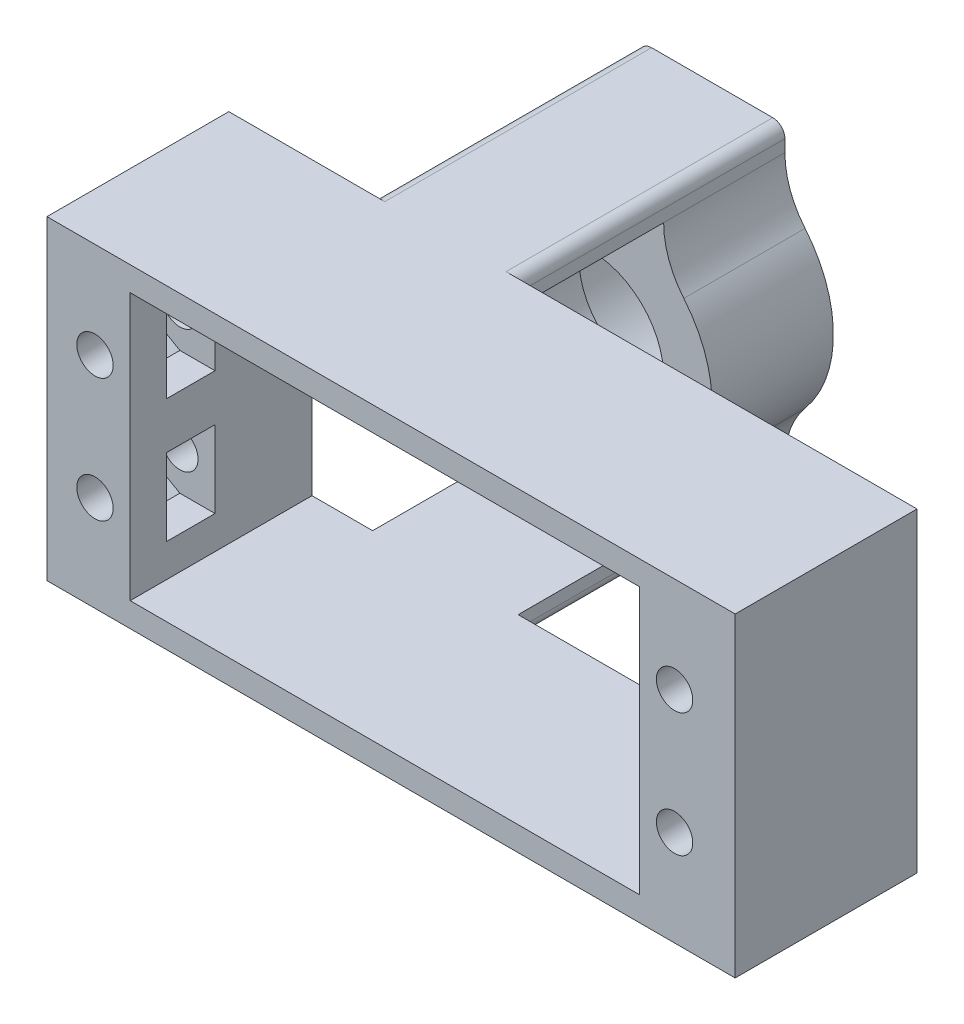
from build123d import *

# Parameters (mm, degrees)
ESQUISSE1_W                   = 80
ESQUISSE1_H                   = 26
BOSS_EXTRU_1_DEPTH            = 5
ESQUISSE4_W                   = 15
ESQUISSE4_H                   = 21
BOSS_EXTRU_2_DEPTH            = 23
ESQUISSE6_R                   = 1.9
ENL_V_MAT_EXTRU_1_DEPTH       = 23
ESQUISSE7_R                   = 2.5
ENL_V_MAT_EXTRU_2_DEPTH       = 33
ESQUISSE8_W                   = 23.844388633
ESQUISSE8_H                   = 15
ENL_V_MAT_EXTRU_3_DEPTH       = 20
ENL_V_MAT_EXTRU_4_DEPTH       = 20
ENL_V_MAT_EXTRU_5_DEPTH       = 25
ENL_V_MAT_EXTRU_7_DEPTH       = 25
ENL_V_MAT_EXTRU_8_DEPTH       = 1
BOSS_EXTRU_3_DEPTH            = 2
ESQUISSE15_R                  = 1.5
ENL_V_MAT_EXTRU_9_DEPTH       = 19
ESQUISSE17_W                  = 42
ESQUISSE17_H                  = 22
ENL_V_MAT_EXTRU_11_DEPTH      = 19
ENL_V_MAT_EXTRU_12_DEPTH      = 2
BOSS_EXTRU_4_DEPTH            = 22
BOSS_EXTRU_5_DEPTH            = 10
ESQUISSE25_R                  = 8
ENL_V_MAT_EXTRU_13_DEPTH      = 5
ESQUISSE26_R                  = 6
ENL_V_MAT_EXTRU_14_DEPTH      = 5
BOSS_EXTRU_7_DEPTH            = 10
ESQUISSE35_W                  = 3.859922035
ESQUISSE35_H                  = 6.350852961
ESQUISSE35_W_2                = 3.756368621
ESQUISSE35_W_3                = 10.8376001
ESQUISSE35_W_4                = 8.369035633
ENL_V_MAT_EXTRU_17_DEPTH      = 12
ESQUISSE37_W                  = 8.298839711
ESQUISSE37_H                  = 26
BOSS_EXTRU_8_DEPTH            = 8
BOSS_EXTRU_9_DEPTH            = 21
ENL_V_START                   = -10
ESQUISSE42_R                  = 1.5
ENL_V_MAT_EXTRU_18_DEPTH      = 10
ENL_V_MAT_EXTRU_19_DEPTH      = 70.721697714
ENL_V_MAT_EXTRU_19_DEPTH_BACK = 70.721697714
ESQUISSE43_W                  = 41.770498162
ESQUISSE43_H                  = 26


with BuildPart() as part:
    # Esquisse1 → Boss.-Extru.1 (new body)
    with BuildSketch(Plane.XY):
        with Locations((16.761307699, -3.439862543)):
            Rectangle(ESQUISSE1_W, ESQUISSE1_H)
    extrude(amount=BOSS_EXTRU_1_DEPTH)

    # Esquisse4 → Boss.-Extru.2 (add)
    with BuildSketch(Plane(origin=(0, 0, 0), x_dir=(-1, 0, 0), z_dir=(0, 0, -1))):
        with Locations((30.738692301, -3.439862543)):
            Rectangle(ESQUISSE4_W, ESQUISSE4_H)
    extrude(amount=-BOSS_EXTRU_2_DEPTH)

    # Esquisse6 → Enlèv. mat.-Extru.1 (cut)
    with BuildSketch(Plane.XZ.offset(13.939862543)):
        with Locations((-28.738692301, 5)):
            Circle(ESQUISSE6_R)
    extrude(amount=-ENL_V_MAT_EXTRU_1_DEPTH, mode=Mode.SUBTRACT)

    # Esquisse7 → Enlèv. mat.-Extru.2 (cut)
    with BuildSketch(Plane.XY.offset(23)):
        with Locations((-33.238692301, -3.439862543)):
            Circle(ESQUISSE7_R)
    extrude(amount=-ENL_V_MAT_EXTRU_2_DEPTH, mode=Mode.SUBTRACT)

    # Esquisse8 → Enlèv. mat.-Extru.3 (cut)
    with BuildSketch(Plane(origin=(0, 0, 0), x_dir=(-1, 0, 0), z_dir=(0, 0, -1))):
        with Locations((38.160886617, -3.439862543)):
            Rectangle(ESQUISSE8_W, ESQUISSE8_H)
    extrude(amount=-ENL_V_MAT_EXTRU_3_DEPTH, mode=Mode.SUBTRACT)

    # Esquisse9 → Enlèv. mat.-Extru.4 (cut)
    with BuildSketch(Plane(origin=(0, 0, 0), x_dir=(-1, 0, 0), z_dir=(0, 0, -1))):
        with BuildLine():
            Line((23.238692301, 7.060137457), (23.238692301, 9.560137457))
            Line((23.238692301, 9.560137457), (17.813492819, 9.560137457))
            ThreePointArc((17.813492819, 9.560137457), (20.800246467, 8.905073311), (23.238692301, 7.060137457))
        make_face()
        with BuildLine():
            Line((17.813492819, -16.439862543), (23.238692301, -16.439862543))
            Line((23.238692301, -16.439862543), (23.238692301, -13.939862543))
            ThreePointArc((23.238692301, -13.939862543), (20.800246467, -15.784798397), (17.813492819, -16.439862543))
        make_face()
    extrude(amount=-ENL_V_MAT_EXTRU_4_DEPTH, mode=Mode.SUBTRACT)

    # Esquisse10 → Enlèv. mat.-Extru.5 (cut)
    with BuildSketch(Plane.XZ.offset(13.939862543)):
        with BuildLine():
            Line((-23.238692301, 21.5), (-23.238692301, 23))
            Line((-23.238692301, 23), (-24.738692301, 23))
            ThreePointArc((-24.738692301, 23), (-23.678032129, 22.560660172), (-23.238692301, 21.5))
        make_face()
    extrude(amount=-ENL_V_MAT_EXTRU_5_DEPTH, mode=Mode.SUBTRACT)

    # Esquisse12 → Enlèv. mat.-Extru.7 (cut)
    with BuildSketch(Plane.XZ.offset(13.939862543)):
        with BuildLine():
            Line((-38.238692301, 23), (-36.738692301, 23))
            ThreePointArc((-36.738692301, 23), (-37.799352472, 22.560660172), (-38.238692301, 21.5))
            Line((-38.238692301, 21.5), (-38.238692301, 23))
        make_face()
    extrude(amount=-ENL_V_MAT_EXTRU_7_DEPTH, mode=Mode.SUBTRACT)

    # Esquisse13 → Enlèv. mat.-Extru.8 (cut)
    with BuildSketch(Plane(origin=(0, 7.060137457, 0), x_dir=(1, 0, 0), z_dir=(0, 1, 0))):
        Polygon((-30.759418243, -1.5), (-32.780144185, -5), (-30.759418243, -8.5), (-26.717966358, -8.5), (-24.697240416, -5), (-26.717966358, -1.5), align=None)
    extrude(amount=-ENL_V_MAT_EXTRU_8_DEPTH, mode=Mode.SUBTRACT)

    # Esquisse14 → Boss.-Extru.3 (add)
    with BuildSketch(Plane(origin=(0, 7.060137457, 0), x_dir=(1, 0, 0), z_dir=(0, 1, 0))):
        Polygon((-25.851940955, 0), (-31.625443646, 0), (-34.512194992, -5), (-31.625443646, -10), (-25.851940955, -10), (-23.238692301, -5.473720558), (-23.238692301, -4.526279442), align=None)
        Polygon((-30.759418243, -1.5), (-32.780144185, -5), (-30.759418243, -8.5), (-26.717966358, -8.5), (-24.697240416, -5), (-26.717966358, -1.5), align=None, mode=Mode.SUBTRACT)
    extrude(amount=BOSS_EXTRU_3_DEPTH)

    # Esquisse15 → Enlèv. mat.-Extru.9 (cut)
    with BuildSketch(Plane(origin=(0, 0, 0), x_dir=(-1, 0, 0), z_dir=(0, 0, -1))):
        with Locations((-51.761307699, -8.539862543)):
            Circle(ESQUISSE15_R)
        with Locations((-51.761307699, 1.660137457)):
            Circle(ESQUISSE15_R)
        with Locations((-3.961307699, -8.539862543)):
            Circle(ESQUISSE15_R)
        with Locations((-3.961307699, 1.660137457)):
            Circle(ESQUISSE15_R)
    extrude(amount=-ENL_V_MAT_EXTRU_9_DEPTH, mode=Mode.SUBTRACT)

    # Esquisse17 → Enlèv. mat.-Extru.11 (cut)
    with BuildSketch(Plane.XY.offset(5)):
        with Locations((27.861307699, -3.439862543)):
            Rectangle(ESQUISSE17_W, ESQUISSE17_H)
    extrude(amount=-ENL_V_MAT_EXTRU_11_DEPTH, mode=Mode.SUBTRACT)

    # Esquisse18 → Enlèv. mat.-Extru.12 (cut)
    with BuildSketch(Plane(origin=(0, 0, 0), x_dir=(-1, 0, 0), z_dir=(0, 0, -1))):
        Polygon((-49.011307699, 3.247850697), (-51.761307699, 4.835563938), (-54.511307699, 3.247850697), (-54.511307699, 0.072424217), (-51.761307699, -1.515289023), (-49.011307699, 0.072424217), (-46.261307699, 1.660137457), align=None)
        Polygon((-49.011307699, -6.952149303), (-51.761307699, -5.364436062), (-54.511307699, -6.952149303), (-54.511307699, -10.127575783), (-51.761307699, -11.715289023), (-49.011307699, -10.127575783), (-46.261307699, -8.539862543), align=None)
        Polygon((-6.711307699, 0.072424217), (-9.461307699, 1.660137457), (-6.711307699, 3.247850697), (-3.961307699, 4.835563938), (-1.211307699, 3.247850697), (-1.211307699, 0.072424217), (-3.961307699, -1.515289023), align=None)
        Polygon((-9.461307699, -8.539862543), (-6.711307699, -6.952149303), (-3.961307699, -5.364436062), (-1.211307699, -6.952149303), (-1.211307699, -10.127575783), (-3.961307699, -11.715289023), (-6.711307699, -10.127575783), align=None)
    extrude(amount=-ENL_V_MAT_EXTRU_12_DEPTH, mode=Mode.SUBTRACT)

    # Esquisse19 → Boss.-Extru.4 (add)
    with BuildSketch(Plane(origin=(0, 0, 0), x_dir=(-1, 0, 0), z_dir=(0, 0, -1))):
        with BuildLine():
            Line((-12.861307699, -16.439862543), (-22.861307699, -16.439862543))
            ThreePointArc((-22.861307699, -16.439862543), (-23.568414481, -16.146969324), (-23.861307699, -15.439862543))
            Line((-23.861307699, -15.439862543), (-23.861307699, -14.439862543))
            Line((-23.861307699, -14.439862543), (-11.861307699, -14.439862543))
            Line((-11.861307699, -14.439862543), (-11.861307699, -15.439862543))
            ThreePointArc((-11.861307699, -15.439862543), (-12.154200918, -16.146969324), (-12.861307699, -16.439862543))
        make_face()
        with BuildLine():
            Line((-23.861307699, 8.560137457), (-23.861307699, 7.560137457))
            Line((-23.861307699, 7.560137457), (-11.861307699, 7.560137457))
            Line((-11.861307699, 7.560137457), (-11.861307699, 8.560137457))
            ThreePointArc((-11.861307699, 8.560137457), (-12.154200918, 9.267244238), (-12.861307699, 9.560137457))
            Line((-12.861307699, 9.560137457), (-22.861307699, 9.560137457))
            ThreePointArc((-22.861307699, 9.560137457), (-23.568414481, 9.267244238), (-23.861307699, 8.560137457))
        make_face()
    extrude(amount=BOSS_EXTRU_4_DEPTH)

    # Esquisse23 → Boss.-Extru.5 (add)
    with BuildSketch(Plane(origin=(0, 0, -22), x_dir=(-1, 0, 0), z_dir=(0, 0, -1))):
        with BuildLine():
            Line((-23.861307699, 8.560137457), (-23.861307699, 7.560137457))
            ThreePointArc((-23.861307699, 7.560137457), (-24.290279557, 5.125218133), (-25.525541276, 2.983495121))
            ThreePointArc((-25.525541276, 2.983495121), (-27.861307699, -3.439862543), (-25.525541276, -9.863220207))
            ThreePointArc((-25.525541276, -9.863220207), (-24.290279557, -12.004943218), (-23.861307699, -14.439862543))
            Line((-23.861307699, -14.439862543), (-23.861307699, -15.439862543))
            ThreePointArc((-23.861307699, -15.439862543), (-23.568414481, -16.146969324), (-22.861307699, -16.439862543))
            Line((-22.861307699, -16.439862543), (-12.861307699, -16.439862543))
            ThreePointArc((-12.861307699, -16.439862543), (-12.154200918, -16.146969324), (-11.861307699, -15.439862543))
            Line((-11.861307699, -15.439862543), (-11.861307699, -14.439862543))
            ThreePointArc((-11.861307699, -14.439862543), (-11.432335842, -12.004943218), (-10.197074123, -9.863220207))
            ThreePointArc((-10.197074123, -9.863220207), (-7.861307699, -3.439862543), (-10.197074123, 2.983495121))
            ThreePointArc((-10.197074123, 2.983495121), (-11.432335842, 5.125218133), (-11.861307699, 7.560137457))
            Line((-11.861307699, 7.560137457), (-11.861307699, 8.560137457))
            ThreePointArc((-11.861307699, 8.560137457), (-12.154200918, 9.267244238), (-12.861307699, 9.560137457))
            Line((-12.861307699, 9.560137457), (-22.861307699, 9.560137457))
            ThreePointArc((-22.861307699, 9.560137457), (-23.568414481, 9.267244238), (-23.861307699, 8.560137457))
        make_face()
    extrude(amount=BOSS_EXTRU_5_DEPTH)

    # Esquisse25 → Enlèv. mat.-Extru.13 (cut)
    with BuildSketch(Plane(origin=(0, 0, -32), x_dir=(-1, 0, 0), z_dir=(0, 0, -1))):
        with Locations((-17.861307699, -3.439862543)):
            Circle(ESQUISSE25_R)
    extrude(amount=-ENL_V_MAT_EXTRU_13_DEPTH, mode=Mode.SUBTRACT)

    # Esquisse26 → Enlèv. mat.-Extru.14 (cut)
    with BuildSketch(Plane(origin=(0, 0, -27), x_dir=(-1, 0, 0), z_dir=(0, 0, -1))):
        with Locations((-17.861307699, -3.439862543)):
            Circle(ESQUISSE26_R)
    extrude(amount=-ENL_V_MAT_EXTRU_14_DEPTH, mode=Mode.SUBTRACT)

    # Esquisse33 → Boss.-Extru.7 (add)
    with BuildSketch(Plane(origin=(0, 0, 0), x_dir=(-1, 0, 0), z_dir=(0, 0, -1))):
        with BuildLine():
            Line((23.238692301, -13.939862543), (23.238692301, 7.060137457))
            ThreePointArc((23.238692301, 7.060137457), (20.800246467, 8.905073311), (17.813492819, 9.560137457))
            Line((17.813492819, 9.560137457), (-12.861307699, 9.560137457))
            ThreePointArc((-12.861307699, 9.560137457), (-12.154200918, 9.267244238), (-11.861307699, 8.560137457))
            Line((-11.861307699, 8.560137457), (-11.861307699, 7.560137457))
            Line((-11.861307699, 7.560137457), (-6.861307699, 7.560137457))
            Line((-6.861307699, 7.560137457), (-6.861307699, 3.161248157))
            Line((-6.861307699, 3.161248157), (-3.961307699, 4.835563938))
            Line((-3.961307699, 4.835563938), (-1.211307699, 3.247850697))
            Line((-1.211307699, 3.247850697), (-1.211307699, 0.072424217))
            Line((-1.211307699, 0.072424217), (-3.961307699, -1.515289023))
            Line((-3.961307699, -1.515289023), (-6.861307699, 0.159026757))
            Line((-6.861307699, 0.159026757), (-6.861307699, -7.038751843))
            Line((-6.861307699, -7.038751843), (-3.961307699, -5.364436062))
            Line((-3.961307699, -5.364436062), (-1.211307699, -6.952149303))
            Line((-1.211307699, -6.952149303), (-1.211307699, -10.127575783))
            Line((-1.211307699, -10.127575783), (-3.961307699, -11.715289023))
            Line((-3.961307699, -11.715289023), (-6.861307699, -10.040973243))
            Line((-6.861307699, -10.040973243), (-6.861307699, -14.439862543))
            Line((-6.861307699, -14.439862543), (-11.861307699, -14.439862543))
            Line((-11.861307699, -14.439862543), (-11.861307699, -15.439862543))
            ThreePointArc((-11.861307699, -15.439862543), (-12.154200918, -16.146969324), (-12.861307699, -16.439862543))
            Line((-12.861307699, -16.439862543), (17.813492819, -16.439862543))
            ThreePointArc((17.813492819, -16.439862543), (20.800246467, -15.784798397), (23.238692301, -13.939862543))
        make_face()
        with BuildLine():
            Line((-56.761307699, -16.439862543), (-22.861307699, -16.439862543))
            ThreePointArc((-22.861307699, -16.439862543), (-23.568414481, -16.146969324), (-23.861307699, -15.439862543))
            Line((-23.861307699, -15.439862543), (-23.861307699, -14.439862543))
            Line((-23.861307699, -14.439862543), (-48.861307699, -14.439862543))
            Line((-48.861307699, -14.439862543), (-48.861307699, -10.040973243))
            Line((-48.861307699, -10.040973243), (-51.761307699, -11.715289023))
            Line((-51.761307699, -11.715289023), (-54.511307699, -10.127575783))
            Line((-54.511307699, -10.127575783), (-54.511307699, -6.952149303))
            Line((-54.511307699, -6.952149303), (-51.761307699, -5.364436062))
            Line((-51.761307699, -5.364436062), (-48.861307699, -7.038751843))
            Line((-48.861307699, -7.038751843), (-48.861307699, 0.159026757))
            Line((-48.861307699, 0.159026757), (-51.761307699, -1.515289023))
            Line((-51.761307699, -1.515289023), (-54.511307699, 0.072424217))
            Line((-54.511307699, 0.072424217), (-54.511307699, 3.247850697))
            Line((-54.511307699, 3.247850697), (-51.761307699, 4.835563938))
            Line((-51.761307699, 4.835563938), (-48.861307699, 3.161248157))
            Line((-48.861307699, 3.161248157), (-48.861307699, 7.560137457))
            Line((-48.861307699, 7.560137457), (-23.861307699, 7.560137457))
            Line((-23.861307699, 7.560137457), (-23.861307699, 8.560137457))
            ThreePointArc((-23.861307699, 8.560137457), (-23.568414481, 9.267244238), (-22.861307699, 9.560137457))
            Line((-22.861307699, 9.560137457), (-56.761307699, 9.560137457))
            Line((-56.761307699, 9.560137457), (-56.761307699, -16.439862543))
        make_face()
    extrude(amount=BOSS_EXTRU_7_DEPTH)

    # Esquisse35 → Enlèv. mat.-Extru.17 (cut)
    with BuildSketch(Plane(origin=(0, 0, -10), x_dir=(-1, 0, 0), z_dir=(0, 0, -1))):
        with Locations((-5.891268716, 1.660137457)):
            Rectangle(ESQUISSE35_W, ESQUISSE35_H)
        with Locations((-5.83949201, -8.539862542)):
            Rectangle(ESQUISSE35_W_2, ESQUISSE35_H)
        with Locations((-46.342507649, 1.660137457)):
            Rectangle(ESQUISSE35_W_3, ESQUISSE35_H)
        with Locations((-47.576789883, -8.539862542)):
            Rectangle(ESQUISSE35_W_4, ESQUISSE35_H)
    extrude(amount=-ENL_V_MAT_EXTRU_17_DEPTH, mode=Mode.SUBTRACT)

    # Esquisse37 → Boss.-Extru.8 (add)
    with BuildSketch(Plane(origin=(0, 0, -10), x_dir=(-1, 0, 0), z_dir=(0, 0, -1))):
        Polygon((-55.51948102, 1.423088184), (-55.51948102, -7.920901253), (-55.066451899, -9.932075987), (-53.340761864, -11.715289023), (-48.861307699, -11.715289023), (-48.861307699, 4.835563938), (-52.662543063, 4.835563938), (-54.892065561, 3.297290773), align=None)
        with Locations((-2.711887844, -3.439862543)):
            Rectangle(ESQUISSE37_W, ESQUISSE37_H)
    extrude(amount=-BOSS_EXTRU_8_DEPTH)

    # Esquisse38 → Boss.-Extru.9 (add)
    with BuildSketch(Plane.XZ.offset(13.939862543)):
        with BuildLine():
            Line((-23.238692301, 21.5), (-23.238692301, 5))
            Line((-23.238692301, 5), (-6.738692301, 5))
            ThreePointArc((-6.738692301, 5), (-18.40595419, 9.83273811), (-23.238692301, 21.5))
        make_face()
    extrude(amount=-BOSS_EXTRU_9_DEPTH)

    # Esquisse42 → Enlèv. mat.-Extru.18 (cut)
    with BuildSketch(Plane.XY.offset(5).offset(ENL_V_START)):
        with Locations(Location((3.961307699, 1.660137457, 0), (0, 0, 180))):
            Circle(ESQUISSE42_R)
        with Locations((3.961307699, -8.539862543)):
            Circle(ESQUISSE42_R)
        with Locations(Location((51.761307699, 1.660137457, 0), (0, 0, 180))):
            Circle(ESQUISSE42_R)
        with Locations(Location((51.761307699, -8.539862543, 0), (0, 0, 180))):
            Circle(ESQUISSE42_R)
    extrude(amount=ENL_V_MAT_EXTRU_18_DEPTH, mode=Mode.SUBTRACT)

    # Esquisse43 → Enlèv. mat.-Extru.19 (cut, two sides: drawn at the far end of the back side and taken through both)
    with BuildSketch(Plane.XY.offset(5).offset(-ENL_V_MAT_EXTRU_19_DEPTH_BACK)):
        with Locations((-20.885249081, -3.439862543)):
            Rectangle(ESQUISSE43_W, ESQUISSE43_H)
    extrude(amount=ENL_V_MAT_EXTRU_19_DEPTH + ENL_V_MAT_EXTRU_19_DEPTH_BACK, mode=Mode.SUBTRACT)


solid = part.part
